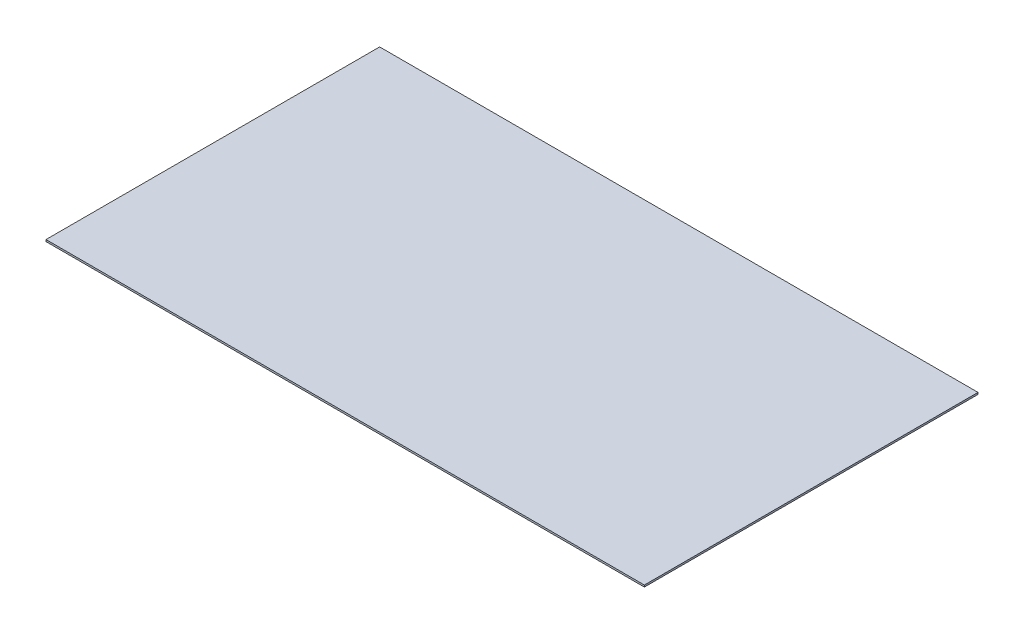
from build123d import *

# Parameters (mm, degrees)
SKETCH1_W           = 165
SKETCH1_H           = 92
BOSS_EXTRUDE1_DEPTH = 0.5


with BuildPart() as part:
    # Sketch1 → Boss-Extrude1 (new body)
    with BuildSketch(Plane(origin=(0, 0, 0), x_dir=(1, 0, 0), z_dir=(0, 1, 0))):
        with Locations((82.5, 46)):
            Rectangle(SKETCH1_W, SKETCH1_H)
    extrude(amount=BOSS_EXTRUDE1_DEPTH)


solid = part.part
